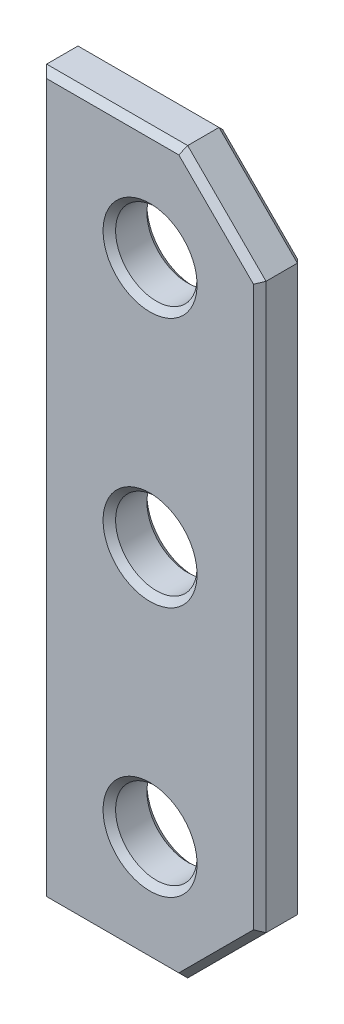
from build123d import *

# Parameters (mm, degrees)
SKETCH_1_R        = 13
EXTRUDE_413_DEPTH = 14
CHAMFER_1_SIZE    = 2


with BuildPart() as part:
    # 草图1 → Extrude 413 (new body)
    with BuildSketch(Plane.XY):
        Polygon((0, 0), (45, 0), (70, 25), (70, 205), (45, 230), (0, 230), align=None)
        with Locations((35, 35)):
            Circle(SKETCH_1_R, mode=Mode.SUBTRACT)
        with Locations((35, 115)):
            Circle(SKETCH_1_R, mode=Mode.SUBTRACT)
        with Locations((35, 195)):
            Circle(SKETCH_1_R, mode=Mode.SUBTRACT)
    extrude(amount=EXTRUDE_413_DEPTH)

    # 倒角1
    chamfer_1_edges = [part.edges().sort_by_distance(p)[0] for p in [
        (57.5, 12.5, 14),
        (70, 115, 14),
        (57.5, 217.5, 14),
        (22, 35, 0),
        (22, 35, 14),
        (22.5, 230, 14),
        (22, 115, 0),
        (22, 115, 14),
        (22, 195, 0),
        (22, 195, 14),
        (0, 115, 14),
        (22.5, 230, 0),
        (57.5, 217.5, 0),
        (70, 115, 0),
        (22.5, 0, 14),
        (57.5, 12.5, 0),
        (22.5, 0, 0),
        (0, 115, 0),
    ]]
    chamfer(chamfer_1_edges, length=CHAMFER_1_SIZE)


solid = part.part
